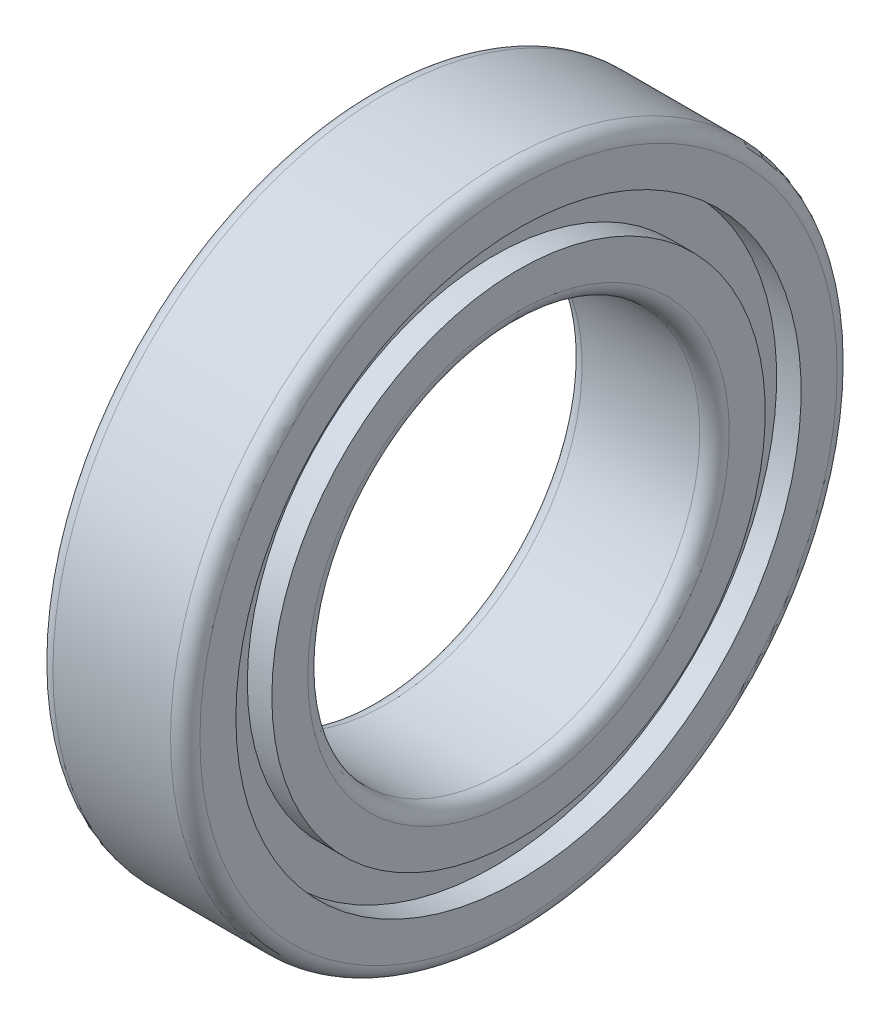
from build123d import *


with BuildPart() as part:
    # Эскиз1 → Повернуть1 (revolve)
    with BuildSketch(Plane.XY, mode=Mode.PRIVATE) as revolve_1_sk:
        with BuildLine():
            Line((6, 20), (-6, 20))
            ThreePointArc((-6, 20), (-7.060660172, 20.439339828), (-7.5, 21.5))
            Line((-7.5, 21.5), (-7.5, 25.166666667))
            Line((-7.5, 25.166666667), (-5, 25.166666667))
            Line((-5, 25.166666667), (-5, 28.833333333))
            Line((-5, 28.833333333), (-7.5, 28.833333333))
            Line((-7.5, 28.833333333), (-7.5, 32.5))
            ThreePointArc((-7.5, 32.5), (-7.060660172, 33.560660172), (-6, 34))
            Line((-6, 34), (6, 34))
            ThreePointArc((6, 34), (7.060660172, 33.560660172), (7.5, 32.5))
            Line((7.5, 32.5), (7.5, 28.833333333))
            Line((7.5, 28.833333333), (5, 28.833333333))
            Line((5, 28.833333333), (5, 25.166666667))
            Line((5, 25.166666667), (7.5, 25.166666667))
            Line((7.5, 25.166666667), (7.5, 21.5))
            ThreePointArc((7.5, 21.5), (7.060660172, 20.439339828), (6, 20))
        make_face()
    revolve(revolve_1_sk.sketch.rotate(Axis((-1000, 0, 0), (1, 0, 0)), 90), axis=Axis((-1000, 0, 0), (1, 0, 0)))


solid = part.part
